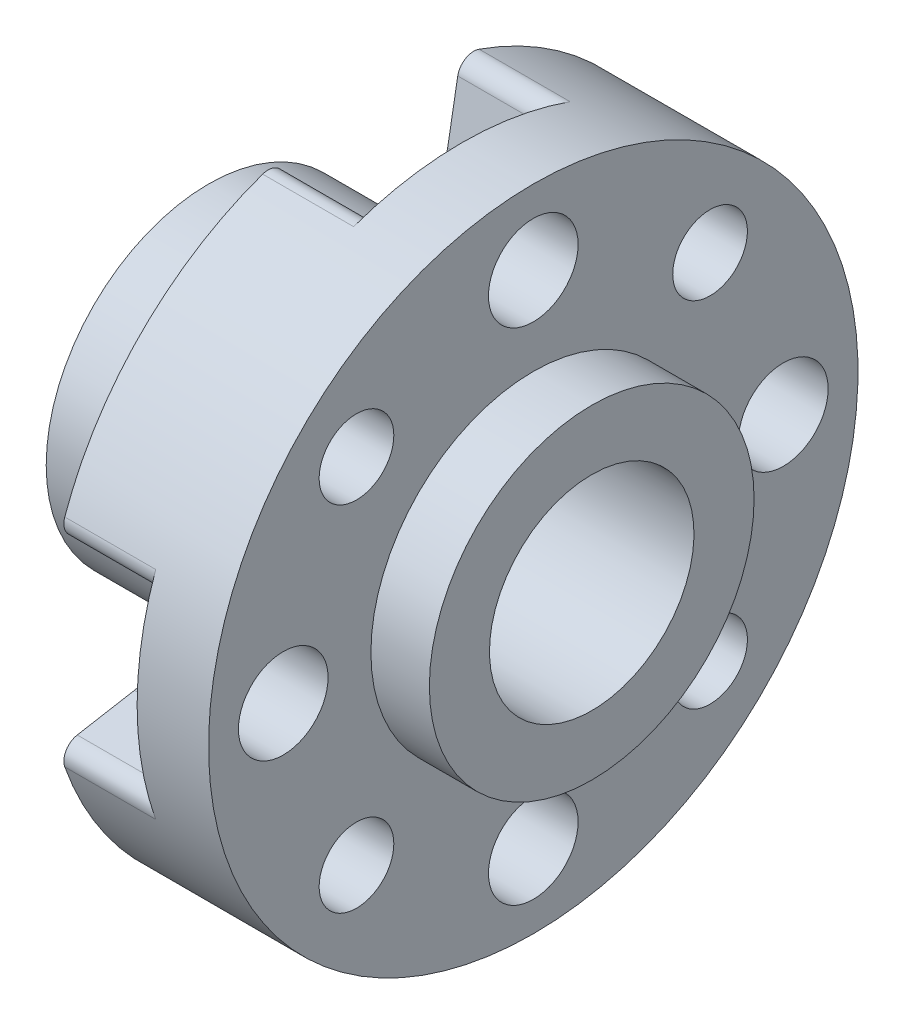
from build123d import *

# Parameters (mm, degrees)
CUT_EXTRUDE2_DEPTH      = 20.92888597
CUT_EXTRUDE2_DEPTH_BACK = 20.92888597
SKETCH2_3_R             = 1.7526
SKETCH2_3_R_2           = 1.4605
SKETCH2_R               = 1.7526
CUT_EXTRUDE1_DEPTH      = 3.556
FILLET1_R               = 0.635


with BuildPart() as part:
    # Sketch1 → Revolve1 (revolve)
    with BuildSketch(Plane.XY):
        Polygon((-14.986, 6.35), (-8.636, 6.35), (-8.636, 12.7), (-2.286, 12.7), (-2.286, 6.35), (0, 6.35), (0, 4), (-14.986, 4), align=None)
    revolve(axis=Axis((0, 0, 0), (-1, 0, 0)))

    # Sketch2<3> → Cut-Extrude2 (cut, two sides: drawn at the far end of the back side and taken through both)
    with BuildSketch(Plane.ZY.offset(8.636).offset(-CUT_EXTRUDE2_DEPTH_BACK)):
        with Locations((-9.779, 0)):
            Circle(SKETCH2_3_R)
        with Locations((0, 9.779)):
            Circle(SKETCH2_3_R)
        with Locations((9.779, 0)):
            Circle(SKETCH2_3_R)
        with Locations((0, -9.779)):
            Circle(SKETCH2_3_R)
        with Locations((-6.914797213, 6.914797213)):
            Circle(SKETCH2_3_R_2)
        with Locations((6.914797213, 6.914797213)):
            Circle(SKETCH2_3_R_2)
        with Locations((6.914797213, -6.914797213)):
            Circle(SKETCH2_3_R_2)
        with Locations((-6.914797213, -6.914797213)):
            Circle(SKETCH2_3_R_2)
    extrude(amount=CUT_EXTRUDE2_DEPTH + CUT_EXTRUDE2_DEPTH_BACK, mode=Mode.SUBTRACT)

    # Sketch2 → Cut-Extrude1 (cut)
    # profile 1 of 4: a face of its own
    with BuildSketch(Plane.ZY.offset(8.636)):
        with BuildLine():
            Line((-12.201800216, -3.52222536), (-9.249720354, -3.001694031))
            ThreePointArc((-9.249720354, -3.001694031), (-6.731, 0), (-9.249720354, 3.001694031))
            Line((-9.249720354, 3.001694031), (-12.201800216, 3.52222536))
            ThreePointArc((-12.201800216, 3.52222536), (-12.7, 0), (-12.201800216, -3.52222536))
        make_face()
        with Locations((-9.779, 0)):
            Circle(SKETCH2_R, mode=Mode.SUBTRACT)
    # profile 2 of 4: a face of its own
    with BuildSketch(Plane.ZY.offset(8.636)):
        with BuildLine():
            Line((-3.001694031, -9.249720354), (-3.52222536, -12.201800216))
            ThreePointArc((-3.52222536, -12.201800216), (0, -12.7), (3.52222536, -12.201800216))
            Line((3.52222536, -12.201800216), (3.001694031, -9.249720354))
            ThreePointArc((3.001694031, -9.249720354), (0, -6.731), (-3.001694031, -9.249720354))
        make_face()
        with Locations((0, -9.779)):
            Circle(SKETCH2_R, mode=Mode.SUBTRACT)
    # profile 3 of 4: a face of its own
    with BuildSketch(Plane.ZY.offset(8.636)):
        with BuildLine():
            ThreePointArc((3.52222536, 12.201800216), (0, 12.7), (-3.52222536, 12.201800216))
            Line((-3.52222536, 12.201800216), (-3.001694031, 9.249720354))
            ThreePointArc((-3.001694031, 9.249720354), (0, 6.731), (3.001694031, 9.249720354))
            Line((3.001694031, 9.249720354), (3.52222536, 12.201800216))
        make_face()
        with Locations((0, 9.779)):
            Circle(SKETCH2_R, mode=Mode.SUBTRACT)
    # profile 4 of 4: a face of its own
    with BuildSketch(Plane.ZY.offset(8.636)):
        with BuildLine():
            Line((9.249720354, -3.001694031), (12.201800216, -3.52222536))
            ThreePointArc((12.201800216, -3.52222536), (12.7, 0), (12.201800216, 3.52222536))
            Line((12.201800216, 3.52222536), (9.249720354, 3.001694031))
            ThreePointArc((9.249720354, 3.001694031), (6.731, 0), (9.249720354, -3.001694031))
        make_face()
        with Locations((9.779, 0)):
            Circle(SKETCH2_R, mode=Mode.SUBTRACT)
    extrude(amount=-CUT_EXTRUDE1_DEPTH, mode=Mode.SUBTRACT)

    # Fillet1
    fillet1_edges = [part.edges().sort_by_distance(p)[0] for p in [
        (-6.858, 12.201800216, -3.52222536),
        (-6.858, 12.201800216, 3.52222536),
        (-6.858, 3.52222536, 12.201800216),
        (-6.858, -3.52222536, 12.201800216),
        (-6.858, -12.201800216, 3.52222536),
        (-6.858, -12.201800216, -3.52222536),
        (-6.858, -3.52222536, -12.201800216),
        (-6.858, 3.52222536, -12.201800216),
    ]]
    fillet(fillet1_edges, radius=FILLET1_R)


solid = part.part
